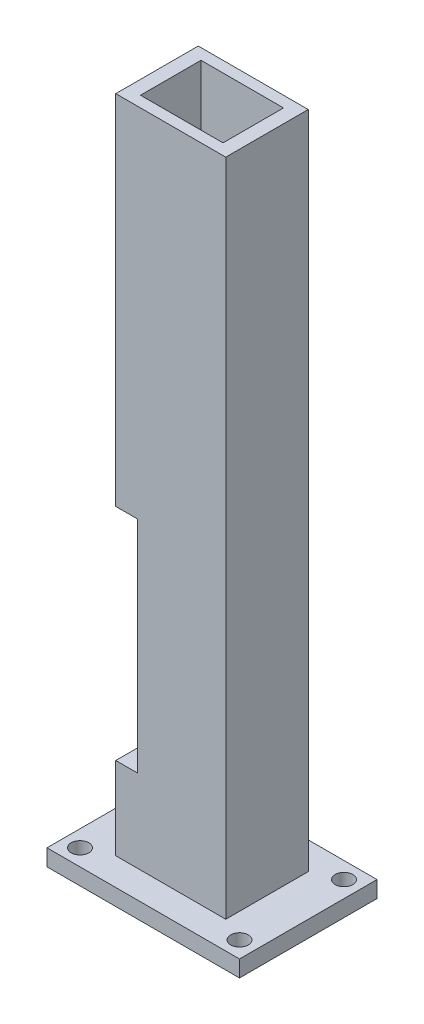
from build123d import *

# Parameters (mm, degrees)
SKETCH_1_W          = 35
SKETCH_1_H          = 25
EXTRUDE_1_DEPTH     = 3
SKETCH_2_W          = 20
SKETCH_2_H          = 15
EXTRUDE_2_DEPTH     = 120
CUT_EXTRUDE_1_REACH = 126.866
SKETCH_3_W          = 15
SKETCH_3_H          = 11
CUT_EXTRUDE_2_REACH = 127.838
SKETCH_4_W          = 4
SKETCH_4_H          = 40
CUT_EXTRUDE_3_REACH = 123.912
SKETCH_5_R          = 1.6


with BuildPart() as part:
    # 草图1 → 凸台-拉伸1 (new body)
    with BuildSketch(Plane(origin=(0, 0, 0), x_dir=(1, 0, 0), z_dir=(0, 1, 0))):
        Rectangle(SKETCH_1_W, SKETCH_1_H)
    extrude(amount=EXTRUDE_1_DEPTH)

    # 草图2 → 凸台-拉伸2 (add)
    with BuildSketch(Plane(origin=(0, 3, 0), x_dir=(1, 0, 0), z_dir=(0, 1, 0))):
        Rectangle(SKETCH_2_W, SKETCH_2_H)
    extrude(amount=EXTRUDE_2_DEPTH)

    # 草图3 → 切除-拉伸1 (cut, up to next)
    with BuildSketch(Plane(origin=(0, 123, 0), x_dir=(1, 0, 0), z_dir=(0, 1, 0)), mode=Mode.PRIVATE) as cut_extrude_1_sk1:
        Rectangle(SKETCH_3_W, SKETCH_3_H)
    cut_extrude_1_tool1 = extrude(cut_extrude_1_sk1.sketch, amount=-CUT_EXTRUDE_1_REACH, mode=Mode.PRIVATE) & part.part
    add(cut_extrude_1_tool1.solids().sort_by_distance((0, 123, 0))[0], mode=Mode.SUBTRACT)

    # 草图4 → 切除-拉伸2 (cut, up to next)
    with BuildSketch(Plane.XY.offset(7.5), mode=Mode.PRIVATE) as cut_extrude_2_sk1:
        with Locations((-8, 38)):
            Rectangle(SKETCH_4_W, SKETCH_4_H)
    cut_extrude_2_tool1 = extrude(cut_extrude_2_sk1.sketch, amount=-CUT_EXTRUDE_2_REACH, mode=Mode.PRIVATE) & part.part
    add(cut_extrude_2_tool1.solids().sort_by_distance((-8, 38, 7.5))[0], mode=Mode.SUBTRACT)

    # 草图5 → 切除-拉伸3 (cut, up to next)
    with BuildSketch(Plane(origin=(0, 3, 0), x_dir=(1, 0, 0), z_dir=(0, 1, 0)), mode=Mode.PRIVATE) as cut_extrude_3_sk1:
        with Locations(Location((-14.5, 9.5, 0), (0, 0, 270))):
            Circle(SKETCH_5_R)
    cut_extrude_3_tool1 = extrude(cut_extrude_3_sk1.sketch, amount=-CUT_EXTRUDE_3_REACH, mode=Mode.PRIVATE) & part.part
    # 草图5 → 切除-拉伸3 (cut, up to next)
    with BuildSketch(Plane(origin=(0, 3, 0), x_dir=(1, 0, 0), z_dir=(0, 1, 0)), mode=Mode.PRIVATE) as cut_extrude_3_sk2:
        with Locations(Location((14.5, 9.5, 0), (0, 0, 270))):
            Circle(SKETCH_5_R)
    cut_extrude_3_tool2 = extrude(cut_extrude_3_sk2.sketch, amount=-CUT_EXTRUDE_3_REACH, mode=Mode.PRIVATE) & part.part
    # 草图5 → 切除-拉伸3 (cut, up to next)
    with BuildSketch(Plane(origin=(0, 3, 0), x_dir=(1, 0, 0), z_dir=(0, 1, 0)), mode=Mode.PRIVATE) as cut_extrude_3_sk3:
        with Locations(Location((-14.5, -9.5, 0), (0, 0, 270))):
            Circle(SKETCH_5_R)
    cut_extrude_3_tool3 = extrude(cut_extrude_3_sk3.sketch, amount=-CUT_EXTRUDE_3_REACH, mode=Mode.PRIVATE) & part.part
    # 草图5 → 切除-拉伸3 (cut, up to next)
    with BuildSketch(Plane(origin=(0, 3, 0), x_dir=(1, 0, 0), z_dir=(0, 1, 0)), mode=Mode.PRIVATE) as cut_extrude_3_sk4:
        with Locations(Location((14.5, -9.5, 0), (0, 0, 270))):
            Circle(SKETCH_5_R)
    cut_extrude_3_tool4 = extrude(cut_extrude_3_sk4.sketch, amount=-CUT_EXTRUDE_3_REACH, mode=Mode.PRIVATE) & part.part
    add(cut_extrude_3_tool1.solids().sort_by_distance((-14.5, 3, -9.5))[0], mode=Mode.SUBTRACT)
    add(cut_extrude_3_tool2.solids().sort_by_distance((14.5, 3, -9.5))[0], mode=Mode.SUBTRACT)
    add(cut_extrude_3_tool3.solids().sort_by_distance((-14.5, 3, 9.5))[0], mode=Mode.SUBTRACT)
    add(cut_extrude_3_tool4.solids().sort_by_distance((14.5, 3, 9.5))[0], mode=Mode.SUBTRACT)


solid = part.part
